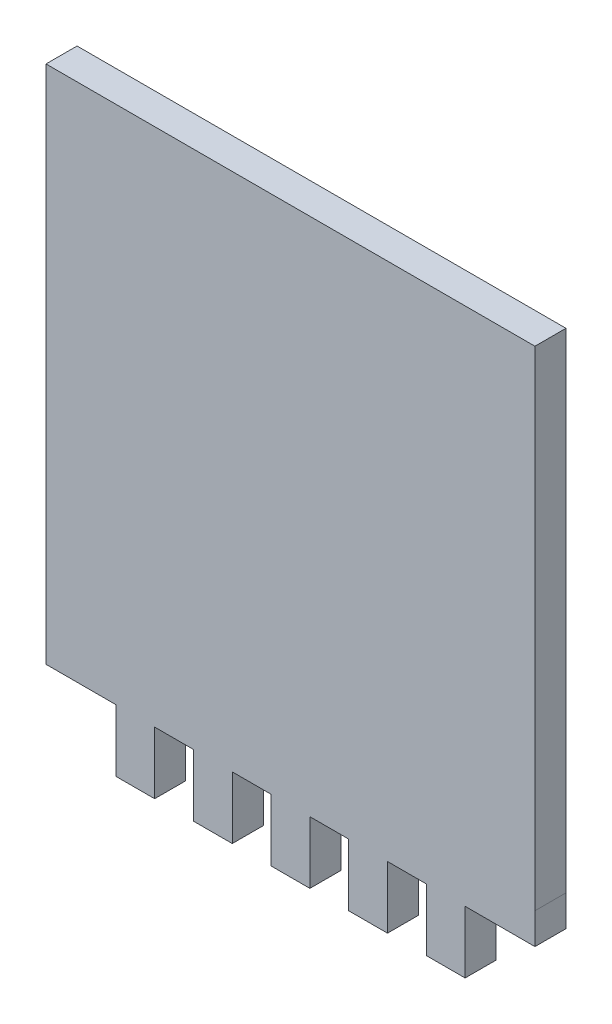
from build123d import *

# Parameters (mm, degrees)
BOSS_EXTRUDE1_DEPTH = 5.08
SKETCH2_W           = 6.35
SKETCH2_H           = 10.16
SKETCH2_W_2         = 3.175
BOSS_EXTRUDE2_DEPTH = 5.08
SKETCH3_W           = 80
SKETCH3_H           = 80
BOSS_EXTRUDE3_DEPTH = 5.08


with BuildPart() as part:
    # Sketch1 → Boss-Extrude1 (new body)
    with BuildSketch(Plane.XY):
        Polygon((-32.320960724, -5.005294118), (-32.320960724, 34.994705882), (5.779039276, 34.994705882), (5.779039276, -5.005294118), (26.728959276, -5.005294118), (26.728959276, -10.085294118), (-53.271040724, -10.085294118), (-53.271040724, -5.005294118), align=None)
    extrude(amount=BOSS_EXTRUDE1_DEPTH)

    # Sketch2 → Boss-Extrude2 (add)
    with BuildSketch(Plane.XY.offset(5.08)):
        with Locations((-38.670960724, -15.165294118)):
            Rectangle(SKETCH2_W, SKETCH2_H)
        with Locations((-25.970960724, -15.165294118)):
            Rectangle(SKETCH2_W, SKETCH2_H)
        with Locations((-14.858460724, -15.165294118)):
            Rectangle(SKETCH2_W_2, SKETCH2_H)
        with Locations((-11.683460724, -15.165294118)):
            Rectangle(SKETCH2_W_2, SKETCH2_H)
        with Locations((-0.570960724, -15.165294118)):
            Rectangle(SKETCH2_W, SKETCH2_H)
        with Locations((12.129039276, -15.165294118)):
            Rectangle(SKETCH2_W, SKETCH2_H)
    extrude(amount=-BOSS_EXTRUDE2_DEPTH)

    # Sketch3 → Boss-Extrude3 (add)
    with BuildSketch(Plane.XY.offset(5.08)):
        with Locations((-13.270960724, 34.994705882)):
            Rectangle(SKETCH3_W, SKETCH3_H)
    extrude(amount=-BOSS_EXTRUDE3_DEPTH)


solid = part.part
